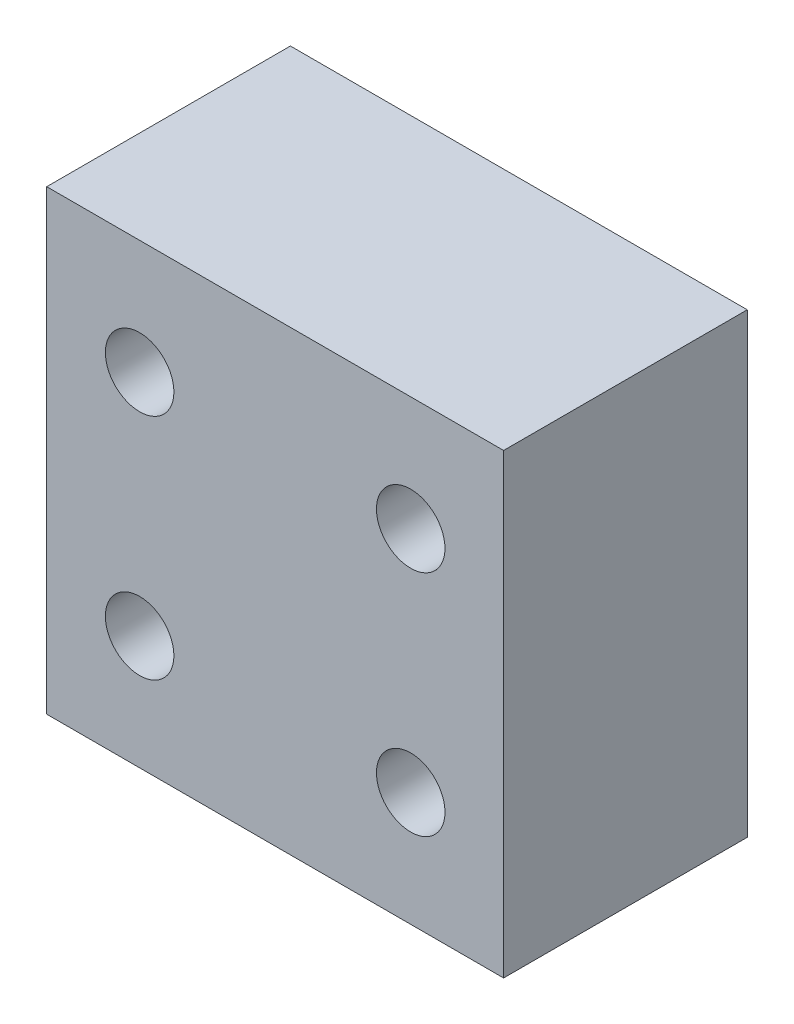
from build123d import *

# Parameters (mm, degrees)
SKETCH_1_W          = 30
SKETCH_1_H          = 30
EXTRUDE_1_DEPTH     = 16
SKETCH_4_R          = 2.25
CUT_EXTRUDE_2_DEPTH = 27.570660511


with BuildPart() as part:
    # 草图1 → 凸台-拉伸1 (new body)
    with BuildSketch(Plane.XY):
        Rectangle(SKETCH_1_W, SKETCH_1_H)
    extrude(amount=EXTRUDE_1_DEPTH)

    # 草图4 → 切除-拉伸2 (cut, through all)
    with BuildSketch(Plane.XY.offset(16)):
        with Locations((8.9, 7.5)):
            Circle(SKETCH_4_R)
        with Locations((8.9, -7.5)):
            Circle(SKETCH_4_R)
        with Locations((-8.9, 7.5)):
            Circle(SKETCH_4_R)
        with Locations((-8.9, -7.5)):
            Circle(SKETCH_4_R)
    extrude(amount=-CUT_EXTRUDE_2_DEPTH, mode=Mode.SUBTRACT)


solid = part.part
